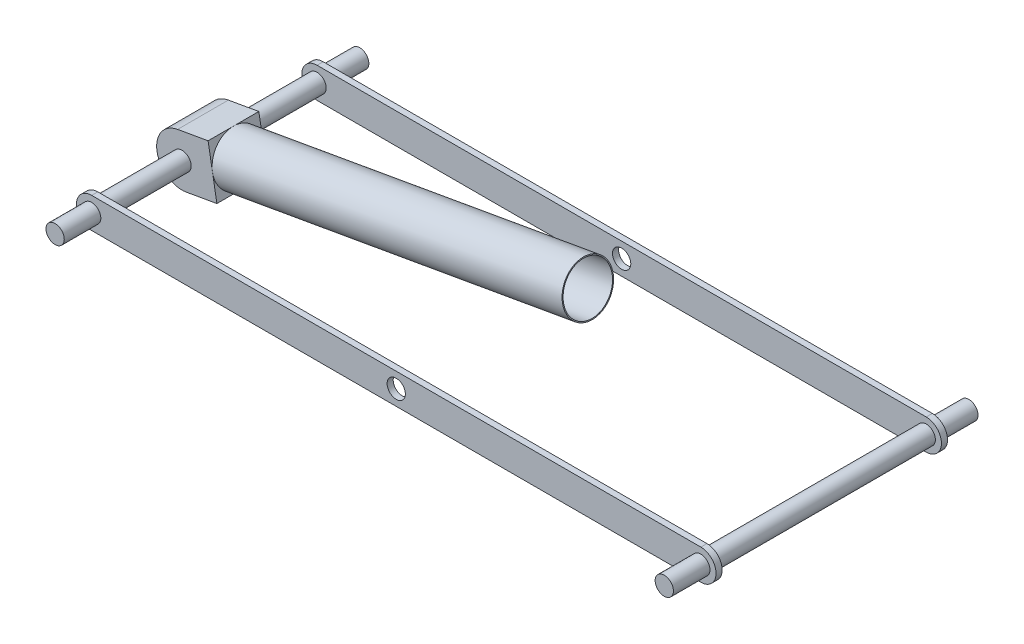
from build123d import *

# Parameters (mm, degrees)
SKETCH_1_R          = 15
EXTRUDE_1_DEPTH     = 250
EXTRUDE_1_2_DEPTH   = 250
EXTRUDE_2_DEPTH     = 10
SKETCH_3_R          = 15
CUT_EXTRUDE_1_DEPTH = 250
EXTRUDE_3_DEPTH     = 25
SKETCH_5_R          = 25
SKETCH_5_R_2        = 24
EXTRUDE_4_DEPTH     = 350
SCALE_1_SCALE       = 0.6


with BuildPart() as part:
    # 草图1 → 凸台-拉伸1 (new, symmetric)
    with BuildSketch(Plane.XY):
        Circle(SKETCH_1_R)
    extrude(amount=EXTRUDE_1_DEPTH, both=True)


with BuildPart() as body_2:
    # 草图1 → Extrude 1 2 (new, symmetric)
    with BuildSketch(Plane.XY):
        with Locations((1000, 0)):
            Circle(SKETCH_1_R)
    extrude(amount=EXTRUDE_1_2_DEPTH, both=True)


with BuildPart() as body_3:
    # 草图2 → 凸台-拉伸2 (new body)
    with BuildSketch(Plane.XY.offset(180)):
        with BuildLine():
            Line((0, 25), (1000, 25))
            ThreePointArc((1000, 25), (1025, 0), (1000, -25))
            Line((1000, -25), (0, -25))
            ThreePointArc((0, -25), (-25, 0), (0, 25))
        make_face()
    extrude(amount=EXTRUDE_2_DEPTH)


with BuildPart() as body_4:
    # 镜向2: mirrored copy
    add(body_3.part.mirror(Plane.XY))


with BuildPart() as cut_extrude_1_tool:
    # 草图3 → 切除-拉伸1 (new, symmetric)
    with BuildSketch(Plane.XY):
        with Locations((500, 0)):
            Circle(SKETCH_3_R)
    extrude(amount=CUT_EXTRUDE_1_DEPTH, both=True)


with BuildPart() as body_3_1:
    add(body_3.part)

    # 切除-拉伸1: cut by cut_extrude_1_tool
    add(cut_extrude_1_tool.part, mode=Mode.SUBTRACT)


with BuildPart() as body_4_1:
    add(body_4.part)

    # 切除-拉伸1: cut by cut_extrude_1_tool
    add(cut_extrude_1_tool.part, mode=Mode.SUBTRACT)


with BuildPart() as body_5:
    # 草图4 → 凸台-拉伸3 (new, symmetric)
    with BuildSketch(Plane.XY):
        with BuildLine():
            Line((-4.341204442, 24.620193825), (25.658795558, 29.910003247))
            Line((25.658795558, 29.910003247), (34.341204442, -19.330384404))
            Line((34.341204442, -19.330384404), (4.341204442, -24.620193825))
            ThreePointArc((4.341204442, -24.620193825), (-24.620193825, -4.341204442), (-4.341204442, 24.620193825))
        make_face()
    extrude(amount=EXTRUDE_3_DEPTH, both=True)


with BuildPart() as body_6:
    # 草图5 → 凸台-拉伸4 (new body)
    with BuildSketch(Plane(origin=(30, 5.289809421, 0), x_dir=(0, 0, -1), z_dir=(0.9848077530122079, 0.17364817766693116, 0))):
        with Locations(Location((0, 0, 0), (0, 0, 90))):
            Circle(SKETCH_5_R)
        with Locations(Location((0, 0, 0), (0, 0, 90))):
            Circle(SKETCH_5_R_2, mode=Mode.SUBTRACT)
    extrude(amount=EXTRUDE_4_DEPTH)


with BuildPart() as body_2_1:
    # 缩放比例1: scaled about (0, 0, 0)
    add(body_2.part.scale(SCALE_1_SCALE))


with BuildPart() as body_4_2:
    # 缩放比例1: scaled about (0, 0, 0)
    add(body_4_1.part.scale(SCALE_1_SCALE))


with BuildPart() as part_1:
    # 缩放比例1: scaled about (0, 0, 0)
    add(part.part.scale(SCALE_1_SCALE))


with BuildPart() as body_3_2:
    # 缩放比例1: scaled about (0, 0, 0)
    add(body_3_1.part.scale(SCALE_1_SCALE))


solid = Compound([body_5.part, body_6.part, body_2_1.part, body_4_2.part, part_1.part, body_3_2.part])
